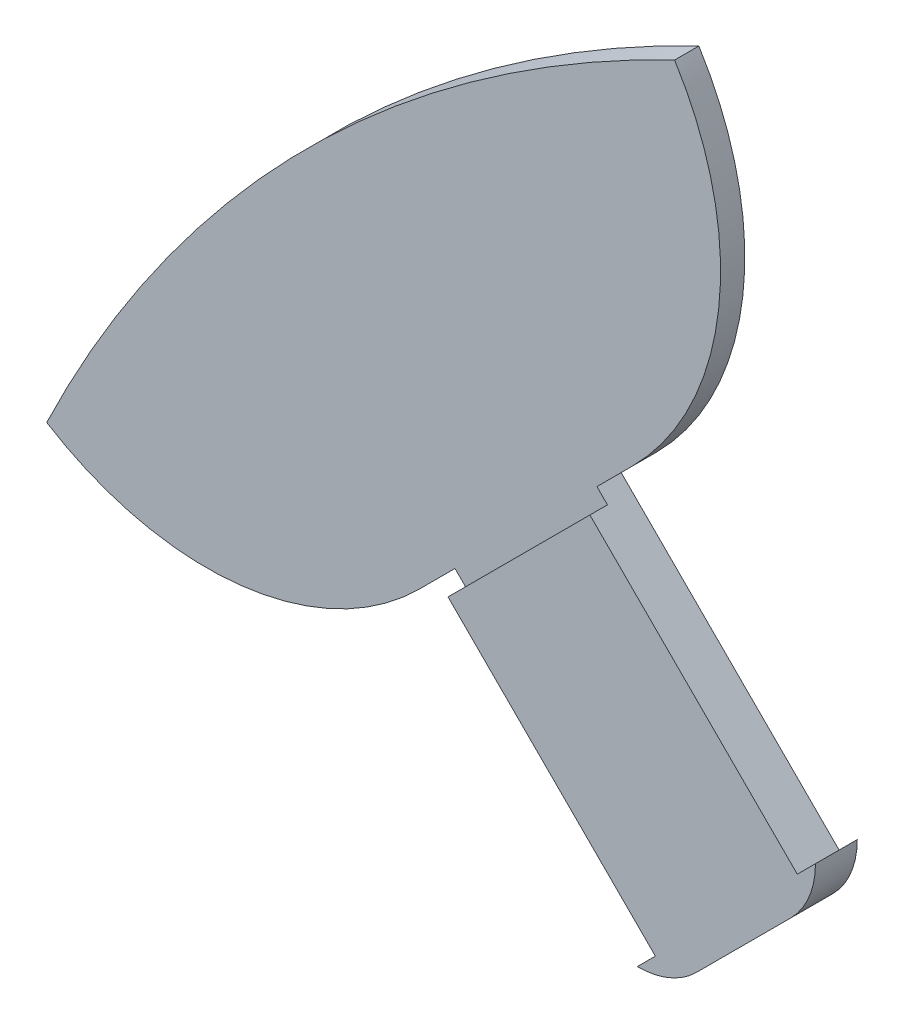
from build123d import *

# Parameters (mm, degrees)
BOSS_EXTRUDE2_DEPTH = 5
CUT_EXTRUDE1_START  = 5
SKETCH3_W           = 19.008841094
SKETCH3_H           = 2.1
SKETCH3_W_2         = 12
SKETCH3_W_3         = 1.535533906
SKETCH3_W_4         = 1.464466094
SKETCH3_W_5         = 17.544375
CUT_EXTRUDE1_DEPTH  = 16
CUT_EXTRUDE2_DEPTH  = 52
SKETCH5_W           = 1.05
SKETCH5_H           = 46.149322856
CUT_EXTRUDE3_DEPTH  = 10


with BuildPart() as part:
    # Sketch1 → Boss-Extrude2 (new body)
    with BuildSketch(Plane.XY):
        Polygon((-39.238867065, 47.72414844), (-47.72414844, 39.238867065), (-34.69381669, 26.208535316), (-26.208535316, 34.69381669), align=None)
        with BuildLine():
            ThreePointArc((-49.845468783, 62.573390845), (-56.568542495, 56.568542495), (-62.573390845, 49.845468783))
            Line((-62.573390845, 49.845468783), (-49.845468783, 37.117546722))
            Line((-49.845468783, 37.117546722), (-47.72414844, 39.238867065))
            Line((-47.72414844, 39.238867065), (-39.238867065, 47.72414844))
            Line((-39.238867065, 47.72414844), (-37.117546722, 49.845468783))
            Line((-37.117546722, 49.845468783), (-49.845468783, 62.573390845))
        make_face()
        with BuildLine():
            ThreePointArc((-34.594119865, 72.133534994), (-42.489529555, 67.783772971), (-49.845468783, 62.573390845))
            Line((-49.845468783, 62.573390845), (-37.117546722, 49.845468783))
            ThreePointArc((-37.117546722, 49.845468783), (-31.959737739, 60.548390845), (-34.594119865, 72.133534994))
        make_face()
        with BuildLine():
            ThreePointArc((-62.573390845, 49.845468783), (-67.783772971, 42.489529555), (-72.133534994, 34.594119865))
            ThreePointArc((-72.133534994, 34.594119865), (-60.548390845, 31.959737739), (-49.845468783, 37.117546722))
            Line((-49.845468783, 37.117546722), (-62.573390845, 49.845468783))
        make_face()
        with BuildLine():
            Line((-34.69381669, 26.208535316), (-35.779603128, 25.122748879))
            ThreePointArc((-35.779603128, 25.122748879), (-33.866185966, 25.503351216), (-32.244069222, 26.587214973))
            Line((-32.244069222, 26.587214973), (-26.587214973, 32.244069222))
            ThreePointArc((-26.587214973, 32.244069222), (-25.503351216, 33.866185966), (-25.122748879, 35.779603128))
            Line((-25.122748879, 35.779603128), (-26.208535316, 34.69381669))
            Line((-26.208535316, 34.69381669), (-34.69381669, 26.208535316))
        make_face()
    extrude(amount=BOSS_EXTRUDE2_DEPTH)

    # Sketch3 → Cut-Extrude1 (cut)
    with BuildSketch(Plane(origin=(-57.699913345, 57.699913345, 0), x_dir=(-0.707106781186549, -0.7071067811865461, 0), z_dir=(0.7071067811865461, -0.707106781186549, 0)).offset(CUT_EXTRUDE1_START)):
        with Locations((-17.039954453, -2.5)):
            Rectangle(SKETCH3_W, SKETCH3_H)
        with Locations((0, -2.5)):
            Rectangle(SKETCH3_W_2, SKETCH3_H)
        with Locations((-6.767766953, -2.5)):
            Rectangle(SKETCH3_W_3, SKETCH3_H)
        with Locations((6.767766953, -2.5)):
            Rectangle(SKETCH3_W_3, SKETCH3_H)
        with Locations((8.267766953, -2.5)):
            Rectangle(SKETCH3_W_4, SKETCH3_H)
        with Locations((17.7721875, -2.5)):
            Rectangle(SKETCH3_W_5, SKETCH3_H)
    extrude(amount=CUT_EXTRUDE1_DEPTH, mode=Mode.SUBTRACT)

    # Sketch4 → Cut-Extrude2 (cut)
    with BuildSketch(Plane(origin=(-57.699913345, 57.699913345, 0), x_dir=(-0.707106781186549, -0.7071067811865461, 0), z_dir=(0.7071067811865461, -0.707106781186549, 0))):
        Polygon((-7.535533906, -2.5), (27.054152634, -2.5), (27.054152634, -6.972921607), (-28.074504585, -6.972921607), (-28.074504585, -2.5), align=None)
    extrude(amount=CUT_EXTRUDE2_DEPTH, mode=Mode.SUBTRACT)

    # Sketch5 → Cut-Extrude3 (cut)
    with BuildSketch(Plane(origin=(-54.164379439, 54.164379439, 0), x_dir=(0, 0, -1), z_dir=(0.7071067811865461, -0.7071067811865489, 0))):
        with Locations((-1.975, 0)):
            Rectangle(SKETCH5_W, SKETCH5_H)
    extrude(amount=-CUT_EXTRUDE3_DEPTH, mode=Mode.SUBTRACT)


solid = part.part
